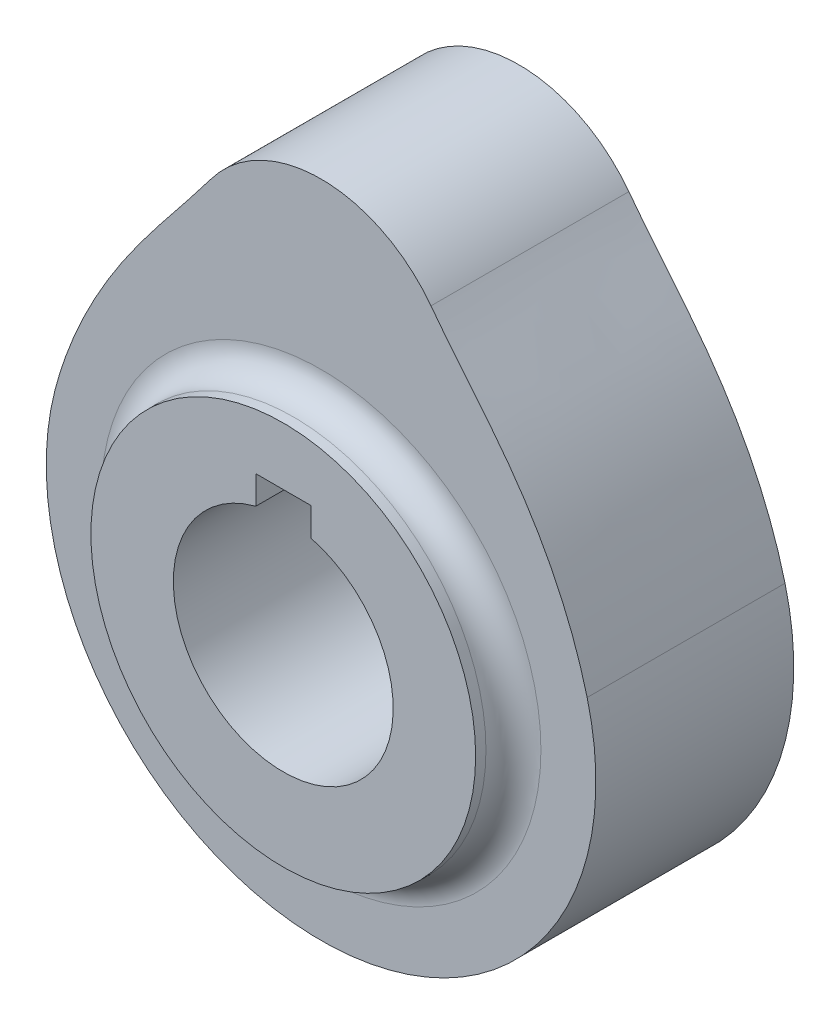
from build123d import *

# Parameters (mm, degrees)
CAMBODY_DEPTH   = 14.4
BOSS_DEPTH      = 2.75
BOSS_DEPTH_BACK = 17.25
SKETCH2_R       = 14
BOSSFILLETS_R   = 2
SKETCH3_R       = 8
BORE_DEPTH      = 40.799497605
SKETCH4_W       = 4
SKETCH4_H       = 5
KEYSLOT_DEPTH   = 40.799497605


with BuildPart() as part:
    # Sketch1 → CamBody (new body)
    with BuildSketch(Plane.XY):
        with BuildLine():
            ThreePointArc((8, 24), (0, 28), (-8, 24))
            add(Edge.make_bspline(
                [(-8, 24), (-9.885763615, 21.485648513), (-14.768346923, 15.874245369), (-18.297603119, 9.133687845), (-19.364916731, 5)],
                knots=[0, 0, 0, 0, 0.425985114, 1, 1, 1, 1], degree=3))
            ThreePointArc((-19.364916731, 5), (0, -20), (19.364916731, 5))
            add(Edge.make_bspline(
                [(19.364916731, 5), (18.228780394, 9.400237112), (14.835269856, 16.032711081), (9.974620681, 21.367172425), (8, 24)],
                knots=[0, 0, 0, 0, 0.579854245, 1, 1, 1, 1], degree=3))
        make_face()
    extrude(amount=CAMBODY_DEPTH)

    # Sketch2 → Boss (add, two sides: drawn at the far end of the back side and taken through both)
    with BuildSketch(Plane.XY.offset(14.4).offset(-BOSS_DEPTH_BACK)):
        Circle(SKETCH2_R)
    extrude(amount=BOSS_DEPTH + BOSS_DEPTH_BACK)

    # BossFillets
    bossfillets_edges = [part.edges().sort_by_distance(p)[0] for p in [
        (-14, 0, 0),
        (-14, 0, 14.4),
    ]]
    fillet(bossfillets_edges, radius=BOSSFILLETS_R)

    # Sketch3 → Bore (cut, through all)
    with BuildSketch(Plane.XY.offset(17.15)):
        Circle(SKETCH3_R)
    extrude(amount=-BORE_DEPTH, mode=Mode.SUBTRACT)

    # Sketch4 → KeySlot (cut, through all)
    with BuildSketch(Plane.XY.offset(17.15)):
        with Locations((0, 7.3)):
            Rectangle(SKETCH4_W, SKETCH4_H)
    extrude(amount=-KEYSLOT_DEPTH, mode=Mode.SUBTRACT)


solid = part.part
